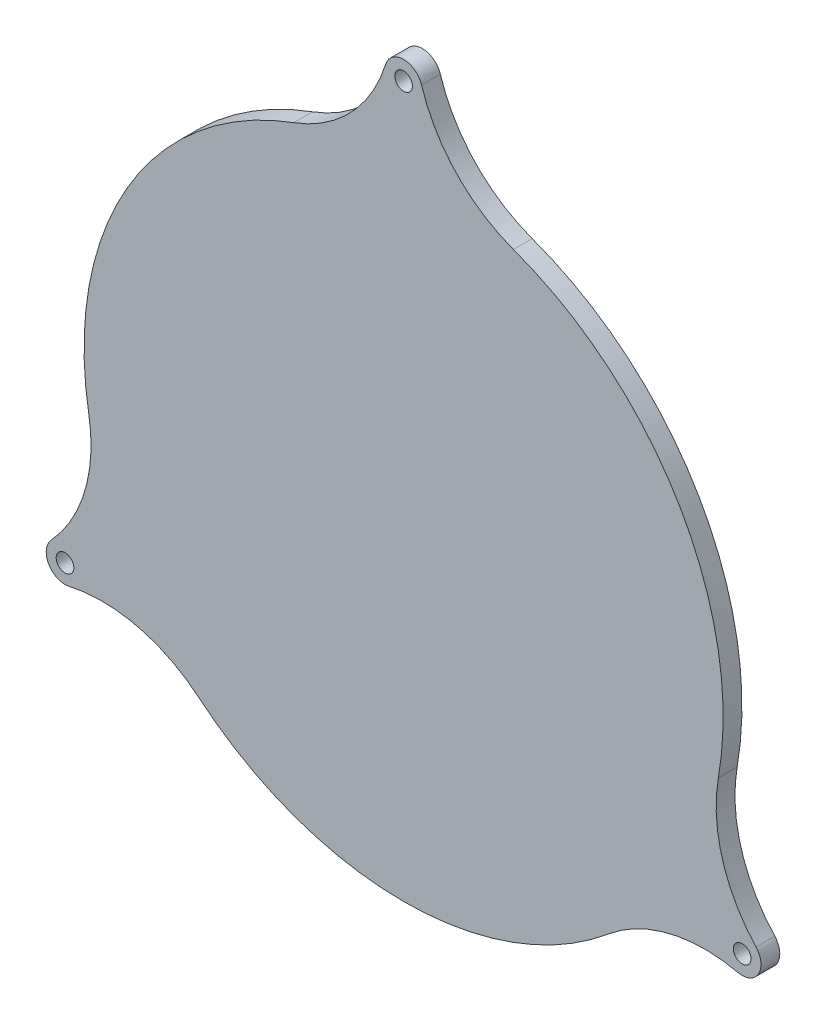
from build123d import *

# Parameters (mm, degrees)
SKETCH1_R           = 2.35
BOSS_EXTRUDE1_DEPTH = 5


with BuildPart() as part:
    # Sketch1 → Boss-Extrude1 (new body)
    with BuildSketch(Plane.XY):
        with BuildLine():
            ThreePointArc((-29.215098796, 79.821538462), (-73.612159322, 42.5), (-83.735029475, -14.6097515))
            ThreePointArc((-83.735029475, -14.6097515), (-84.767114048, -32.77832805), (-93.741431686, -48.60943652))
            ThreePointArc((-93.741431686, -48.60943652), (-94.396769013, -54.5), (-88.967722733, -56.877742968))
            ThreePointArc((-88.967722733, -56.877742968), (-70.770421809, -57.021310146), (-54.519930679, -65.211786962))
            ThreePointArc((-54.519930679, -65.211786962), (0, -85), (54.519930679, -65.211786962))
            ThreePointArc((54.519930679, -65.211786962), (70.770421809, -57.021310146), (88.967722733, -56.877742968))
            ThreePointArc((88.967722733, -56.877742968), (94.396769013, -54.5), (93.741431686, -48.60943652))
            ThreePointArc((93.741431686, -48.60943652), (84.767114048, -32.77832805), (83.735029475, -14.6097515))
            ThreePointArc((83.735029475, -14.6097515), (73.612159322, 42.5), (29.215098796, 79.821538462))
            ThreePointArc((29.215098796, 79.821538462), (13.996692239, 89.799638196), (4.773708954, 105.487179487))
            ThreePointArc((4.773708954, 105.487179487), (0, 109), (-4.773708954, 105.487179487))
            ThreePointArc((-4.773708954, 105.487179487), (-13.996692239, 89.799638196), (-29.215098796, 79.821538462))
        make_face()
        with Locations((0, 104)):
            Circle(SKETCH1_R, mode=Mode.SUBTRACT)
        with Locations((90.066641994, -52)):
            Circle(SKETCH1_R, mode=Mode.SUBTRACT)
        with Locations((-90.066641994, -52)):
            Circle(SKETCH1_R, mode=Mode.SUBTRACT)
    extrude(amount=BOSS_EXTRUDE1_DEPTH)


solid = part.part
